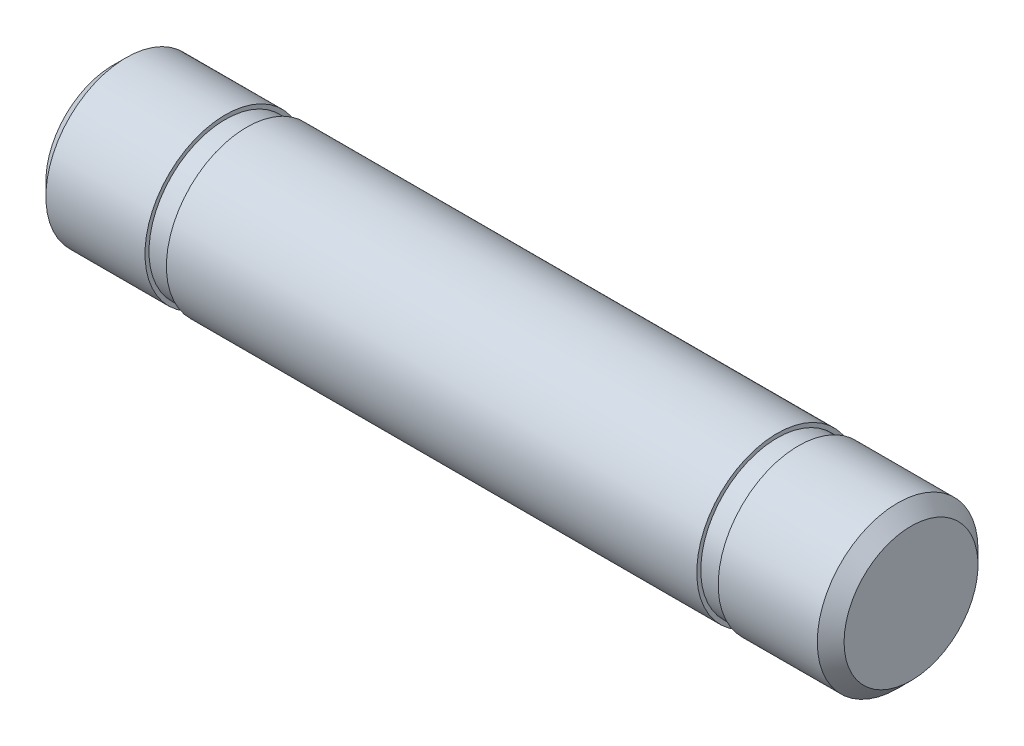
from build123d import *

# Parameters (mm, degrees)
CHAFL_N1_SIZE = 0.5


with BuildPart() as part:
    # Croquis1 → Revolución1 (revolve)
    with BuildSketch(Plane(origin=(0, 0, 0), x_dir=(-1, 0, 0), z_dir=(0, 1, 0)), mode=Mode.PRIVATE) as revoluci_n1_sk:
        Polygon((-9.9, 3), (9.9, 3), (9.9, 2.85), (10.7, 2.85), (10.7, 3), (14.9, 3), (14.9, 0), (-14.9, 0), (-14.9, 3), (-10.7, 3), (-10.7, 2.85), (-9.9, 2.85), align=None)
    revolve(revoluci_n1_sk.sketch.rotate(Axis((14.9, 0, 0), (-1, 0, 0)), 180), axis=Axis((14.9, 0, 0), (-1, 0, 0)))

    # Chaflán1
    chafl_n1_edges = [part.edges().sort_by_distance(p)[0] for p in [
        (14.9, 0, 3),
        (-14.9, 0, 3),
    ]]
    chamfer(chafl_n1_edges, length=CHAFL_N1_SIZE)


solid = part.part
